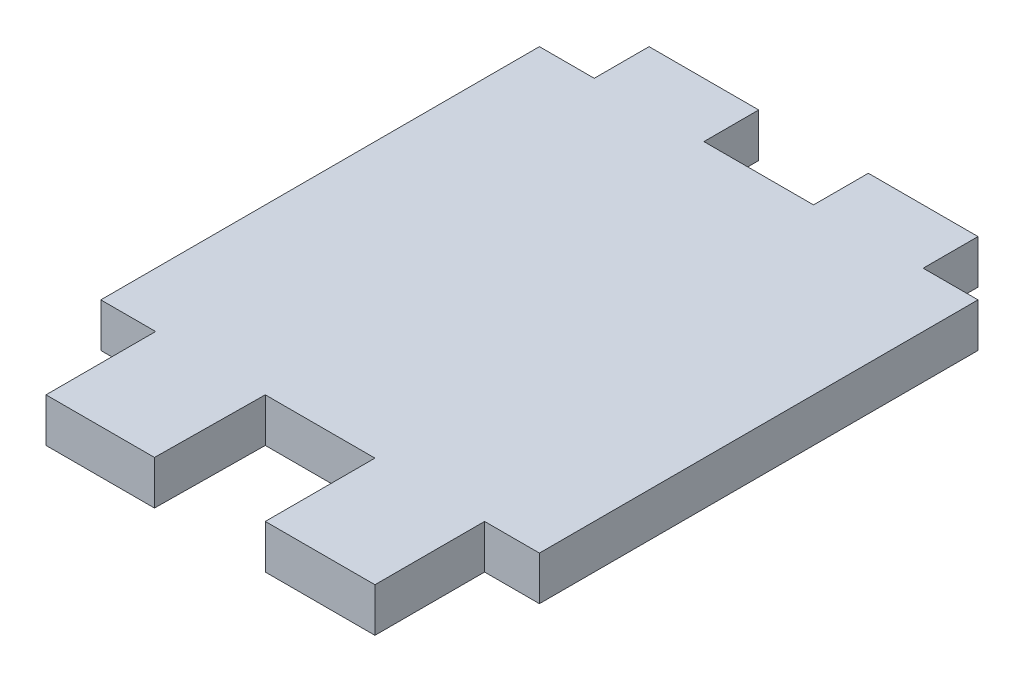
from build123d import *

# Parameters (mm, degrees)
BOSS_EXTRUDE1_DEPTH = 4


with BuildPart() as part:
    # Sketch1 → Boss-Extrude1 (new body)
    with BuildSketch(Plane(origin=(0, 0, 0), x_dir=(1, 0, 0), z_dir=(0, 1, 0))):
        Polygon((-29.466908589, 30.541012597), (-34.466908589, 30.541012597), (-34.466908589, -9.458987403), (-29.466908589, -9.458987403), (-29.466908589, -19.458987403), (-19.574264558, -19.458987403), (-19.466908589, -9.458987403), (-9.466908589, -9.458987403), (-9.466908589, -19.458987403), (0.533091411, -19.458987403), (0.533091411, -9.458987403), (5.533091411, -9.458987403), (5.533091411, 30.541012597), (0.533091411, 30.541012597), (0.533091411, 35.541012597), (-9.466908589, 35.541012597), (-9.466908589, 30.541012597), (-19.466908589, 30.541012597), (-19.466908589, 35.541012597), (-29.466908589, 35.541012597), align=None)
    extrude(amount=BOSS_EXTRUDE1_DEPTH)


solid = part.part
